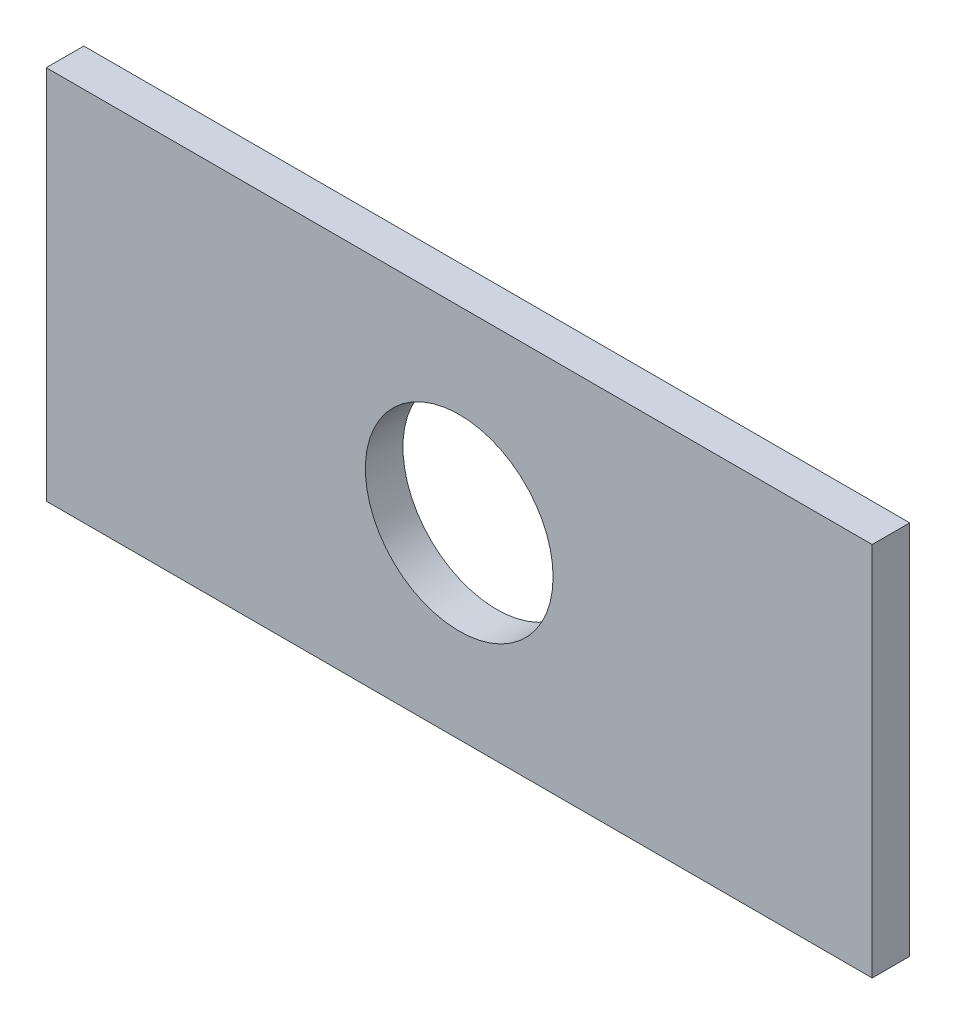
from build123d import *

# Parameters (mm, degrees)
SKETCH1_W           = 11
SKETCH1_H           = 5
SKETCH1_R           = 1.25
BOSS_EXTRUDE1_DEPTH = 0.5
SCALE2_SCALE        = 5


with BuildPart() as part:
    # Sketch1 → Boss-Extrude1 (new body)
    with BuildSketch(Plane.XY):
        with Locations((-44.645074627, 7.944567164)):
            Rectangle(SKETCH1_W, SKETCH1_H)
        with Locations((-44.645074627, 7.944567164)):
            Circle(SKETCH1_R, mode=Mode.SUBTRACT)
    extrude(amount=BOSS_EXTRUDE1_DEPTH)


with BuildPart() as part_1:
    # Scale2: scaled about (0, 0, 0)
    add(part.part.scale(SCALE2_SCALE))


solid = part_1.part
